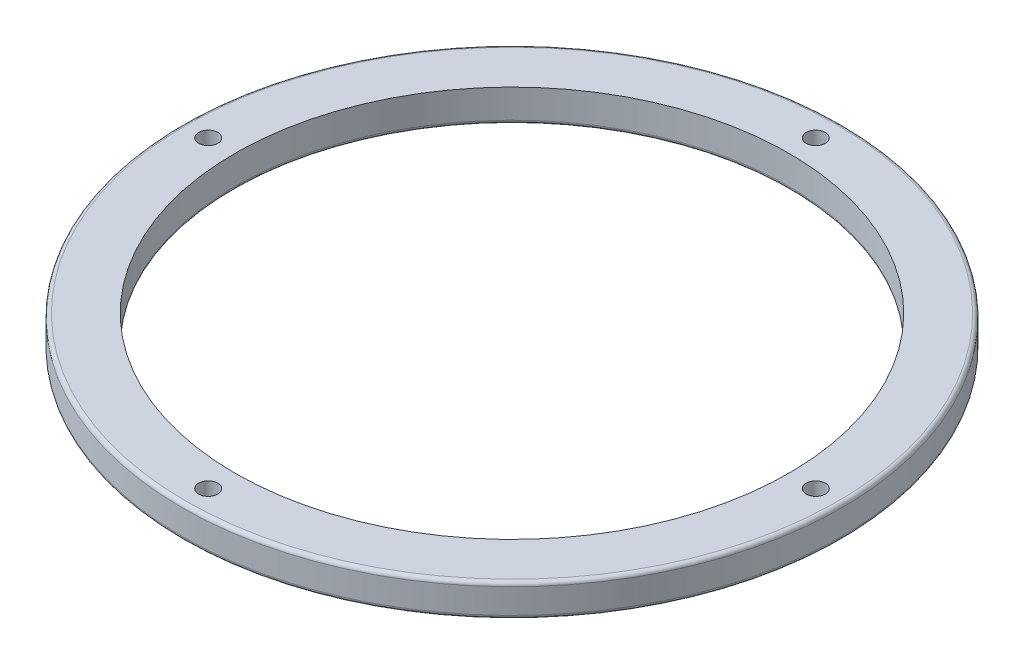
from build123d import *

# Parameters (mm, degrees)
SKETCH1_R           = 86.25
SKETCH1_R_2         = 72.5
BOSS_EXTRUDE1_DEPTH = 8.5
FILLET1_R           = 1
M6_TAPPED_HOLE1_D   = 5


with BuildPart() as part:
    # Sketch1 → Boss-Extrude1 (new body)
    with BuildSketch(Plane(origin=(0, 0, 0), x_dir=(1, 0, 0), z_dir=(0, 1, 0))):
        with Locations(Location((0, 0, 0), (0, 0, 270))):
            Circle(SKETCH1_R)
        with Locations(Location((0, 0, 0), (0, 0, 270))):
            Circle(SKETCH1_R_2, mode=Mode.SUBTRACT)
    extrude(amount=BOSS_EXTRUDE1_DEPTH)

    # Fillet1
    fillet1_edges = [part.edges().sort_by_distance(p)[0] for p in [
        (0, 0, -86.25),
        (0, 8.5, -86.25),
        (0, 0, -72.5),
    ]]
    fillet(fillet1_edges, radius=FILLET1_R)

    # M6 Tapped Hole1 (through all)
    with Locations(Plane(origin=(0, 8.5, 0), x_dir=(1, 0, 0), z_dir=(0, 1, 0))):
        with Locations((0, 79.5), (79.5, 0), (0, -79.5), (-79.5, 0)):
            Hole(M6_TAPPED_HOLE1_D / 2)


solid = part.part
